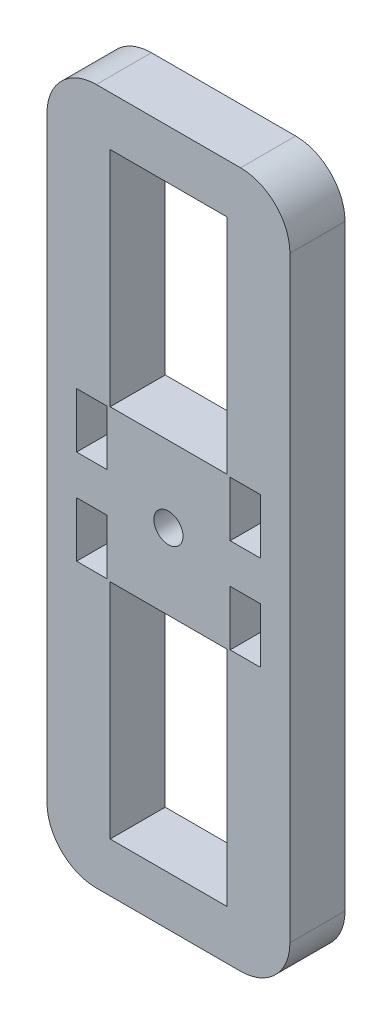
from build123d import *

# Parameters (mm, degrees)
SKETCH1_W           = 3.055
SKETCH1_H           = 5.575
SKETCH1_W_2         = 11.81
SKETCH1_H_2         = 22.57
SKETCH1_R           = 1.475
BOSS_EXTRUDE1_DEPTH = 5.58


with BuildPart() as part:
    # Sketch1 → Boss-Extrude1 (new body)
    with BuildSketch(Plane.XY):
        with BuildLine():
            Line((708.390729089, 432.709671907), (715.695729089, 432.709671907))
            Line((715.695729089, 432.709671907), (723.000729089, 432.709671907))
            ThreePointArc((723.000729089, 432.709671907), (726.536262995, 434.174138001), (728.000729089, 437.709671907))
            Line((728.000729089, 437.709671907), (728.000729089, 498.199671907))
            ThreePointArc((728.000729089, 498.199671907), (726.536262995, 501.735205812), (723.000729089, 503.199671907))
            Line((723.000729089, 503.199671907), (715.695729089, 503.199671907))
            Line((715.695729089, 503.199671907), (708.390729089, 503.199671907))
            ThreePointArc((708.390729089, 503.199671907), (704.855195183, 501.735205812), (703.390729089, 498.199671907))
            Line((703.390729089, 498.199671907), (703.390729089, 437.709671907))
            ThreePointArc((703.390729089, 437.709671907), (704.855195183, 434.174138001), (708.390729089, 432.709671907))
        make_face()
        with Locations((707.918229089, 463.167171907)):
            Rectangle(SKETCH1_W, SKETCH1_H, mode=Mode.SUBTRACT)
        with Locations((715.695729089, 448.994671907)):
            Rectangle(SKETCH1_W_2, SKETCH1_H_2, mode=Mode.SUBTRACT)
        with Locations((715.695729089, 467.954671907)):
            Circle(SKETCH1_R, mode=Mode.SUBTRACT)
        with Locations((723.473229089, 463.167171907)):
            Rectangle(SKETCH1_W, SKETCH1_H, mode=Mode.SUBTRACT)
        with Locations((707.918229089, 472.742171907)):
            Rectangle(SKETCH1_W, SKETCH1_H, mode=Mode.SUBTRACT)
        with Locations((723.473229089, 472.742171907)):
            Rectangle(SKETCH1_W, SKETCH1_H, mode=Mode.SUBTRACT)
        with Locations((715.695729089, 486.914671907)):
            Rectangle(SKETCH1_W_2, SKETCH1_H_2, mode=Mode.SUBTRACT)
    extrude(amount=BOSS_EXTRUDE1_DEPTH)


solid = part.part
